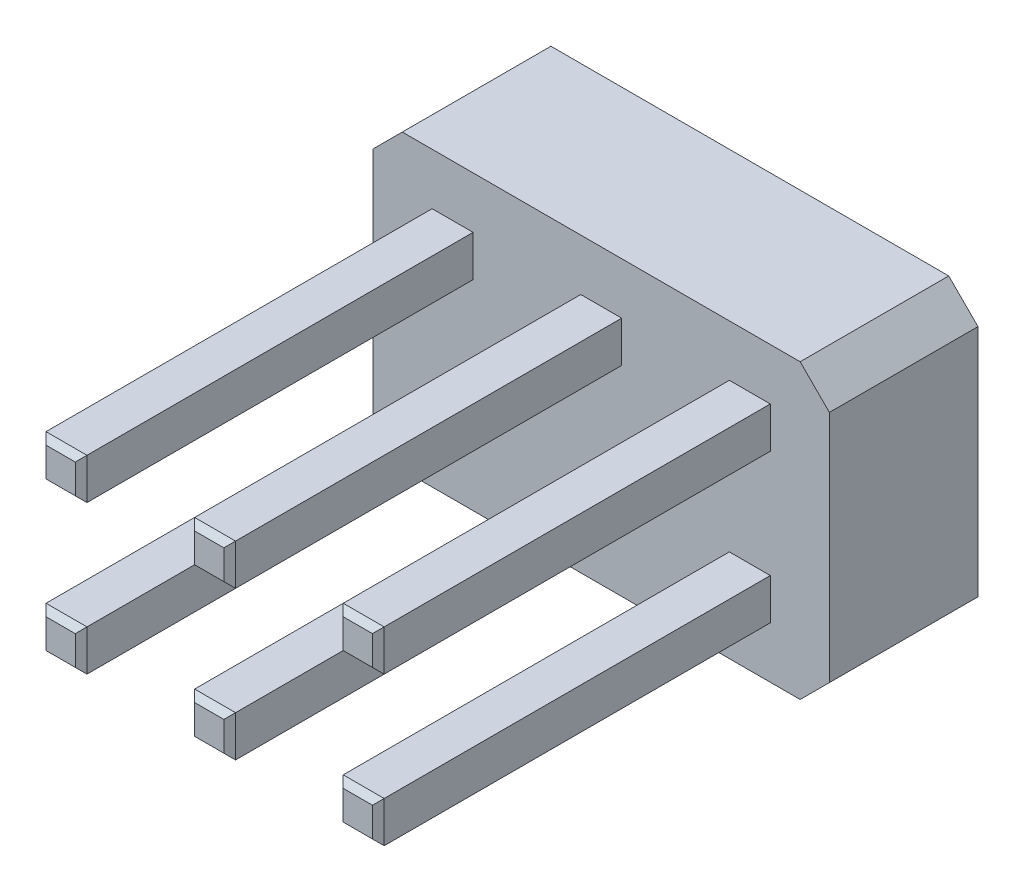
from build123d import *

# Parameters (mm, degrees)
SKETCH1_W           = 7.8
SKETCH1_H           = 5
BOSS_EXTRUDE1_DEPTH = 2.54
SKETCH2_W           = 0.7
SKETCH2_H           = 0.7
BOSS_EXTRUDE2_DEPTH = 6.7
CHAMFER1_SIZE       = 0.5
CHAMFER2_SIZE       = 0.1


with BuildPart() as part:
    # Sketch1 → Boss-Extrude1 (new body)
    with BuildSketch(Plane.XY):
        Rectangle(SKETCH1_W, SKETCH1_H)
    extrude(amount=BOSS_EXTRUDE1_DEPTH)

    # Sketch2 → Boss-Extrude2 (add)
    with BuildSketch(Plane.XY.offset(2.54)):
        with Locations((0, 1.27)):
            Rectangle(SKETCH2_W, SKETCH2_H)
        with Locations((-2.54, 1.27)):
            Rectangle(SKETCH2_W, SKETCH2_H)
        with Locations((2.54, 1.27)):
            Rectangle(SKETCH2_W, SKETCH2_H)
        with Locations((0, -1.27)):
            Rectangle(SKETCH2_W, SKETCH2_H)
        with Locations((2.54, -1.27)):
            Rectangle(SKETCH2_W, SKETCH2_H)
        with Locations((-2.54, -1.27)):
            Rectangle(SKETCH2_W, SKETCH2_H)
    extrude(amount=BOSS_EXTRUDE2_DEPTH)

    # Chamfer1
    chamfer1_edges = [part.edges().sort_by_distance(p)[0] for p in [
        (3.9, -2.5, 1.27),
        (-3.9, -2.5, 1.27),
        (-3.9, 2.5, 1.27),
        (3.9, 2.5, 1.27),
    ]]
    chamfer(chamfer1_edges, length=CHAMFER1_SIZE)

    # Chamfer2
    chamfer2_edges = [part.edges().sort_by_distance(p)[0] for p in [
        (-2.89, 1.27, 9.24),
        (-2.54, 0.92, 9.24),
        (-2.19, 1.27, 9.24),
        (-2.54, 1.62, 9.24),
        (-0.35, 1.27, 9.24),
        (0, 0.92, 9.24),
        (0.35, 1.27, 9.24),
        (0, 1.62, 9.24),
        (2.19, 1.27, 9.24),
        (2.54, 0.92, 9.24),
        (2.89, 1.27, 9.24),
        (2.54, 1.62, 9.24),
        (-0.35, -1.27, 9.24),
        (0, -1.62, 9.24),
        (0.35, -1.27, 9.24),
        (0, -0.92, 9.24),
        (2.19, -1.27, 9.24),
        (2.54, -1.62, 9.24),
        (2.89, -1.27, 9.24),
        (2.54, -0.92, 9.24),
        (-2.89, -1.27, 9.24),
        (-2.54, -1.62, 9.24),
        (-2.19, -1.27, 9.24),
        (-2.54, -0.92, 9.24),
    ]]
    chamfer(chamfer2_edges, length=CHAMFER2_SIZE)


solid = part.part
